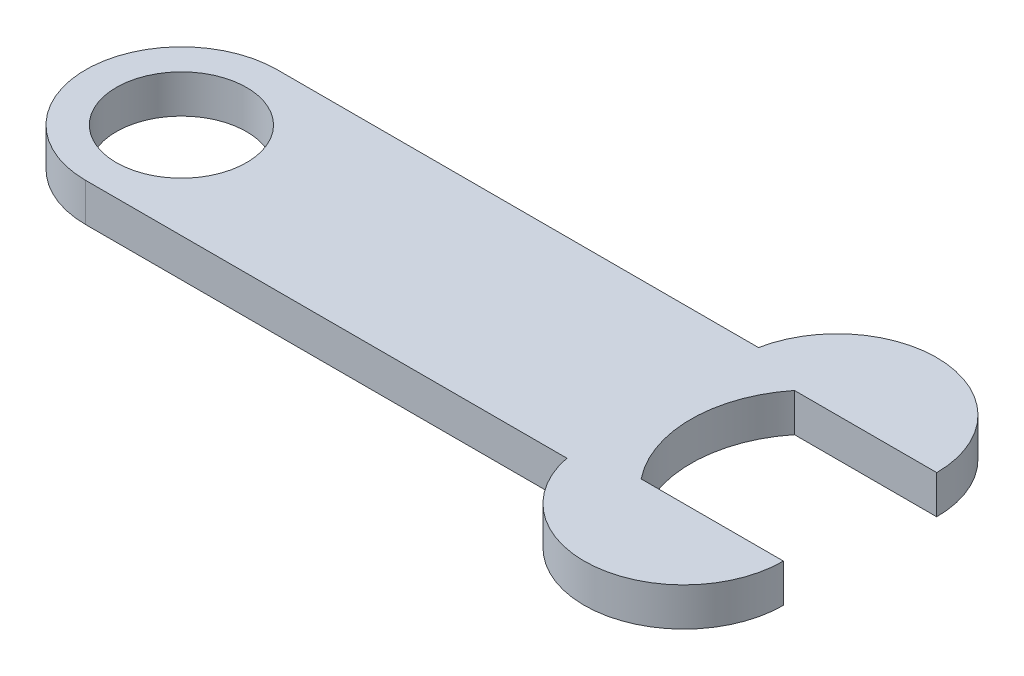
from build123d import *

# Parameters (mm, degrees)
SKETCH1_R           = 17
BOSS_EXTRUDE1_DEPTH = 10


with BuildPart() as part:
    # Sketch1 → Boss-Extrude1 (new body)
    with BuildSketch(Plane(origin=(0, 0, 0), x_dir=(1, 0, 0), z_dir=(0, 1, 0))):
        with BuildLine():
            Line((-24.933996638, 20), (12.2, 20))
            ThreePointArc((12.2, 20), (-11.288251879, 45.878391012), (-39.314701644, 25))
            Line((-39.314701644, 25), (-164.9, 25))
            ThreePointArc((-164.9, 25), (-189.9, 0), (-164.9, -25))
            Line((-164.9, -25), (-39.314701644, -25))
            ThreePointArc((-39.314701644, -25), (-11.288251879, -45.878391012), (12.2, -20))
            Line((12.2, -20), (-24.933996638, -20))
            ThreePointArc((-24.933996638, -20), (-31.954004645, 0), (-24.933996638, 20))
        make_face()
        with Locations(Location((-164.9, 0, 0), (0, 0, 270))):
            Circle(SKETCH1_R, mode=Mode.SUBTRACT)
    extrude(amount=BOSS_EXTRUDE1_DEPTH)


solid = part.part
